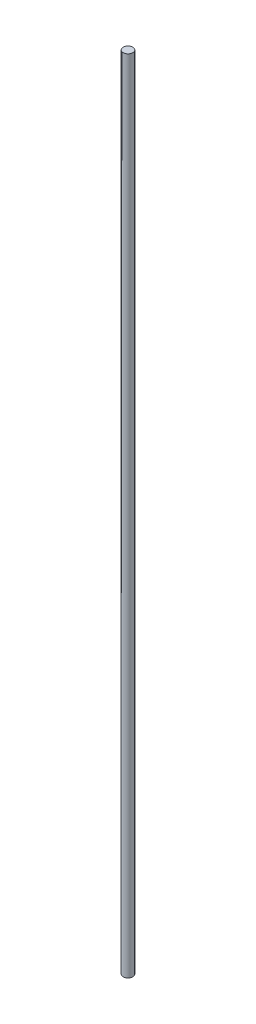
from build123d import *

# Parameters (mm, degrees)
SKETCH_1_R      = 1.5
EXTRUDE_1_DEPTH = 250


with BuildPart() as part:
    # 草图1 → 凸台-拉伸1 (new body)
    with BuildSketch(Plane(origin=(0, 0, 0), x_dir=(1, 0, 0), z_dir=(0, 1, 0))):
        with Locations(Location((-0.7900933, -0.129411834, 0), (0, 0, 270))):
            Circle(SKETCH_1_R)
    extrude(amount=EXTRUDE_1_DEPTH)


solid = part.part
